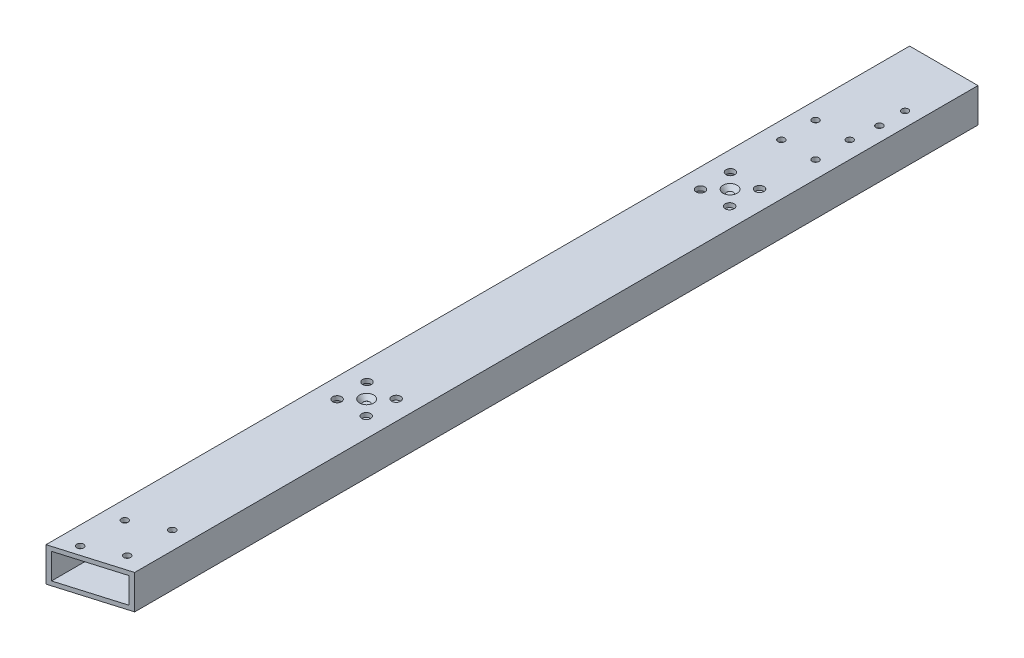
from build123d import *

# Parameters (mm, degrees)
BOSS_EXTRUDE1_DEPTH              = 320.675
BOSS_EXTRUDE1_DEPTH_BACK         = 320.675
SKETCH3_W                        = 50.8
SKETCH3_H                        = 25.4
SKETCH3_W_2                      = 44.45
SKETCH3_H_2                      = 19.05
CUT_EXTRUDE1_DEPTH               = 323.680609311
CUT_EXTRUDE1_DEPTH_BACK          = 323.680609311
F_10_CLEARANCE_HOLE1_D           = 4.9784
F_10_CLEARANCE_HOLE1_DEPTH       = 5.08
F_10_CLEARANCE_HOLE1_TIP         = 1.495662253
F_10_CLEARANCE_HOLE3_D           = 4.9784
F_10_CLEARANCE_HOLE3_DEPTH       = 5.08
F_10_CLEARANCE_HOLE3_TIP         = 1.495662253
F_10_CLEARANCE_HOLE4_D           = 4.9784
F_1_4_CLEARANCE_HOLE1_D          = 6.5278
F_1_4_CLEARANCE_HOLE1_DEPTH      = 5.08
F_1_4_CLEARANCE_HOLE1_TIP        = 1.961148974
F_10_CLEARANCE_HOLE5_D           = 4.9784
F_10_CLEARANCE_HOLE5_DEPTH       = 5.08
F_10_CLEARANCE_HOLE5_CSINK_D     = 10.4394
F_10_CLEARANCE_HOLE5_CSINK_ANGLE = 82
F_10_CLEARANCE_HOLE5_TIP         = 1.495662253
SKETCH25_R                       = 7.9375
CUT_EXTRUDE2_DEPTH               = 323.44622226


with BuildPart() as part:
    # Sketch3 → Boss-Extrude1 (new, two sides: drawn at the far end of the back side and taken through both)
    with BuildSketch(Plane.XY.offset(-BOSS_EXTRUDE1_DEPTH_BACK)):
        Rectangle(SKETCH3_W, SKETCH3_H)
        Rectangle(SKETCH3_W_2, SKETCH3_H_2, mode=Mode.SUBTRACT)
    extrude(amount=BOSS_EXTRUDE1_DEPTH + BOSS_EXTRUDE1_DEPTH_BACK)

    # Sketch4 → Cut-Extrude1 (cut, two sides: drawn at the far end of the back side and taken through both)
    with BuildSketch(Plane(origin=(0, 12.7, 0), x_dir=(1, 0, 0), z_dir=(0, 1, 0)).offset(-CUT_EXTRUDE1_DEPTH_BACK)):
        Polygon((1322.117470931, -320.675), (25.4, -320.675), (-25.4, -320.675), (25.4, -305.627354456), (1268.718301677, 62.660305034), (3837.350959621, 420.474595165), (3890.750128875, 37.139290131), align=None)
    extrude(amount=CUT_EXTRUDE1_DEPTH + CUT_EXTRUDE1_DEPTH_BACK, mode=Mode.SUBTRACT)

    # #10 Clearance Hole1
    with Locations(Plane(origin=(0, 12.7, 0), x_dir=(1, 0, 0), z_dir=(0, 1, 0))):
        with Locations((-11.811, -275.746327933), (-11.811, -308.859955913), (11.811, -297.574221755), (12.047235668, -264.390617583)):
            Hole(F_10_CLEARANCE_HOLE1_D / 2, depth=F_10_CLEARANCE_HOLE1_DEPTH)
            with Locations((0, 0, -(F_10_CLEARANCE_HOLE1_DEPTH + F_10_CLEARANCE_HOLE1_TIP / 2))):  # 118° drill point
                Cone(0, F_10_CLEARANCE_HOLE1_D / 2, F_10_CLEARANCE_HOLE1_TIP, mode=Mode.SUBTRACT)

    # #10 Clearance Hole3
    with Locations(Plane(origin=(0, -12.7, 0), x_dir=(-1, 0, 0), z_dir=(0, -1, 0))):
        with Locations((-12.6238, 299.72), (12.7762, 299.72), (12.7762, 316.23), (-12.6238, 316.23)):
            Hole(F_10_CLEARANCE_HOLE3_D / 2, depth=F_10_CLEARANCE_HOLE3_DEPTH)
            with Locations((0, 0, -(F_10_CLEARANCE_HOLE3_DEPTH + F_10_CLEARANCE_HOLE3_TIP / 2))):  # 118° drill point
                Cone(0, F_10_CLEARANCE_HOLE3_D / 2, F_10_CLEARANCE_HOLE3_TIP, mode=Mode.SUBTRACT)

    # #10 Clearance Hole4 (through all)
    with Locations(Plane(origin=(0, -12.7, 0), x_dir=(-1, 0, 0), z_dir=(0, -1, 0))):
        with Locations((-12.7, 238.125), (12.7, 238.125), (12.7, 212.725), (-12.7, 212.725), (-14.622625311, 277.25194622), (-14.622625311, 258.20194622)):
            Hole(F_10_CLEARANCE_HOLE4_D / 2)

    # 1/4 Clearance Hole1
    with Locations(Plane(origin=(0, 12.7, 0), x_dir=(1, 0, 0), z_dir=(0, 1, 0))):
        with Locations((-10.8204, 173.0375), (10.8204, 173.0375), (10.8204, 150.8125), (-10.8204, 150.8125), (-10.8204, -96.8375), (10.8204, -96.8375), (-10.8204, -119.0625), (10.8204, -119.0625)):
            Hole(F_1_4_CLEARANCE_HOLE1_D / 2, depth=F_1_4_CLEARANCE_HOLE1_DEPTH)
            with Locations((0, 0, -(F_1_4_CLEARANCE_HOLE1_DEPTH + F_1_4_CLEARANCE_HOLE1_TIP / 2))):  # 118° drill point
                Cone(0, F_1_4_CLEARANCE_HOLE1_D / 2, F_1_4_CLEARANCE_HOLE1_TIP, mode=Mode.SUBTRACT)

    # #10 Clearance Hole5
    with Locations(Plane(origin=(0, 12.7, 0), x_dir=(1, 0, 0), z_dir=(0, 1, 0))):
        with Locations((0, -107.95), (0, 161.925)):
            CounterSinkHole(F_10_CLEARANCE_HOLE5_D / 2, F_10_CLEARANCE_HOLE5_CSINK_D / 2, depth=F_10_CLEARANCE_HOLE5_DEPTH, counter_sink_angle=F_10_CLEARANCE_HOLE5_CSINK_ANGLE)
            with Locations((0, 0, -(F_10_CLEARANCE_HOLE5_DEPTH + F_10_CLEARANCE_HOLE5_TIP / 2))):  # 118° drill point
                Cone(0, F_10_CLEARANCE_HOLE5_D / 2, F_10_CLEARANCE_HOLE5_TIP, mode=Mode.SUBTRACT)

    # Sketch25 → Cut-Extrude2 (cut, through all)
    with BuildSketch(Plane(origin=(0, -9.525, 0), x_dir=(1, 0, 0), z_dir=(0, 1, 0))):
        with Locations(Location((0, -107.95, 0), (0, 0, 270))):
            Circle(SKETCH25_R)
        with Locations(Location((0, 161.925, 0), (0, 0, 270))):
            Circle(SKETCH25_R)
    extrude(amount=-CUT_EXTRUDE2_DEPTH, mode=Mode.SUBTRACT)


solid = part.part
